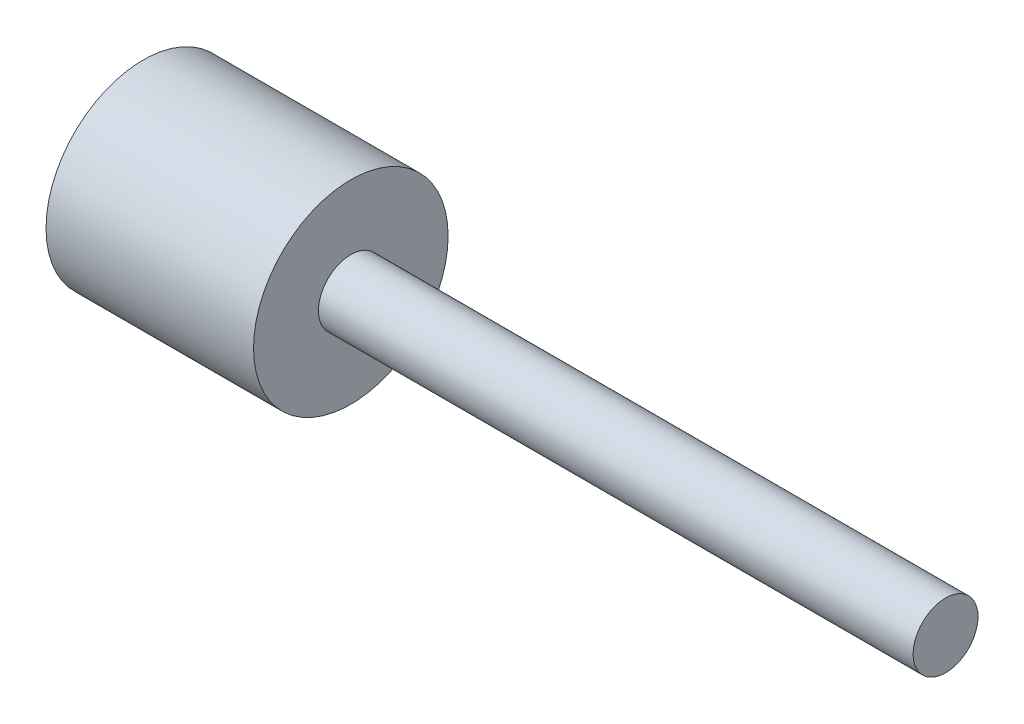
from build123d import *

# Parameters (mm, degrees)
SKETCH1_R               = 7.5
BOSS_EXTRUDE1_DEPTH     = 16
SKETCH2_R               = 2.5
BOSS_EXTRUDE2_DEPTH     = 45.85
CUT_EXTRUDE1_DEPTH      = 12
CUT_EXTRUDE2_REACH      = 65.038
CUT_EXTRUDE2_END_RADIUS = 7.5
SKETCH4_R               = 1.5


with BuildPart() as part:
    # Sketch1 → Boss-Extrude1 (new body)
    with BuildSketch(Plane(origin=(0, 0, 0), x_dir=(0, 0, -1), z_dir=(1, 0, 0))):
        Circle(SKETCH1_R)
    extrude(amount=BOSS_EXTRUDE1_DEPTH)

    # Sketch2 → Boss-Extrude2 (add)
    with BuildSketch(Plane(origin=(16, 0, 0), x_dir=(0, 0, -1), z_dir=(1, 0, 0))):
        Circle(SKETCH2_R)
    extrude(amount=BOSS_EXTRUDE2_DEPTH)

    # Sketch3 → Cut-Extrude1 (cut)
    with BuildSketch(Plane.ZY):
        with BuildLine():
            Line((-2.28035085, -2.1), (2.28035085, -2.1))
            ThreePointArc((2.28035085, -2.1), (0, 3.1), (-2.28035085, -2.1))
        make_face()
    extrude(amount=-CUT_EXTRUDE1_DEPTH, mode=Mode.SUBTRACT)

    # Cut-Extrude2: up to this cylinder (the profile starts inside it)
    cut_extrude2_end = Plane(origin=(5, 0, 0), z_dir=(-1, 0, 0)) * Cylinder(CUT_EXTRUDE2_END_RADIUS, 146.076, mode=Mode.PRIVATE)
    # Sketch4 → Cut-Extrude2 (cut, up to the surface)
    with BuildSketch(Plane(origin=(0, -2.1, 0), x_dir=(1, 0, 0), z_dir=(0, 1, 0)), mode=Mode.PRIVATE) as cut_extrude2_sk1:
        with Locations(Location((5, 0, 0), (0, 0, 270))):
            Circle(SKETCH4_R)
    cut_extrude2_tool1 = extrude(cut_extrude2_sk1.sketch, amount=-CUT_EXTRUDE2_REACH, mode=Mode.PRIVATE) & cut_extrude2_end
    add(cut_extrude2_tool1.solids().sort_by_distance((5, -2.1, 0))[0], mode=Mode.SUBTRACT)


solid = part.part
